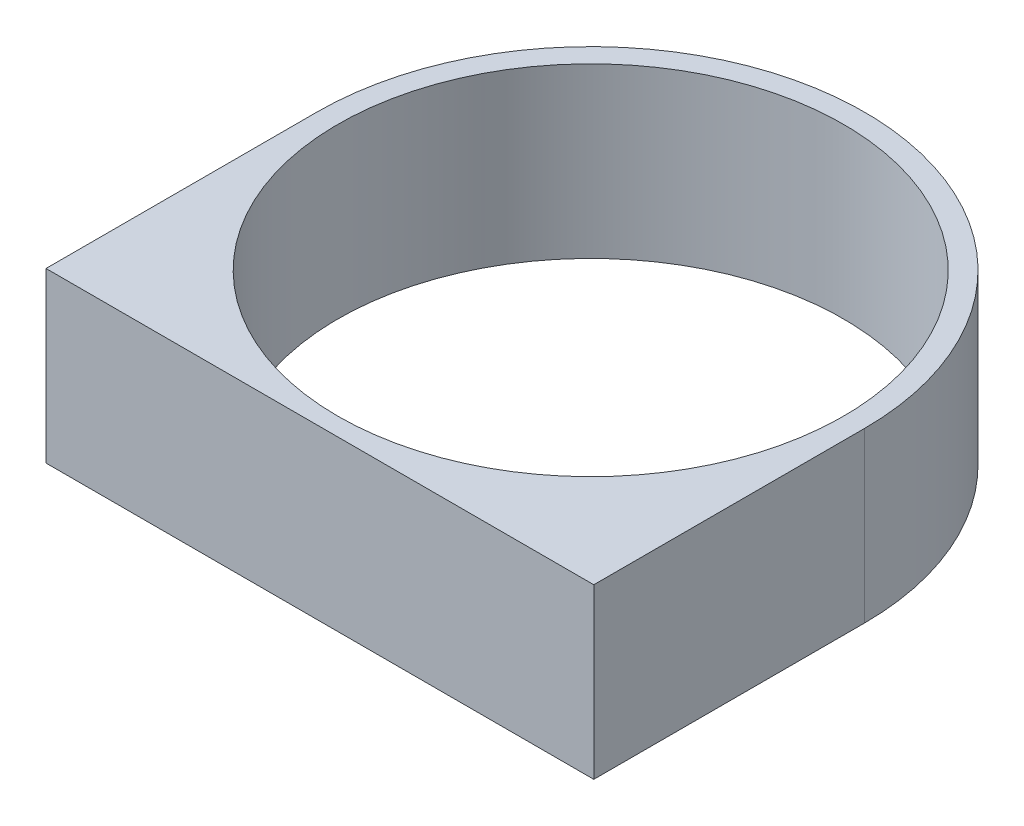
from build123d import *

# Parameters (mm, degrees)
SKETCH1_R           = 3
BOSS_EXTRUDE1_DEPTH = 2


with BuildPart() as part:
    # Sketch1 → Boss-Extrude1 (new body)
    with BuildSketch(Plane(origin=(0, 0, 0), x_dir=(1, 0, 0), z_dir=(0, 1, 0))):
        with BuildLine():
            Line((-3.25, 0), (-3.25, -3.213400023))
            Line((-3.25, -3.213400023), (0.25, -3.213400023))
            Line((0.25, -3.213400023), (3.25, -3.213400023))
            Line((3.25, -3.213400023), (3.25, 0))
            ThreePointArc((3.25, 0), (0, 3.25), (-3.25, 0))
        make_face()
        with Locations(Location((0, 0, 0), (0, 0, 270))):
            Circle(SKETCH1_R, mode=Mode.SUBTRACT)
    extrude(amount=BOSS_EXTRUDE1_DEPTH)


solid = part.part
